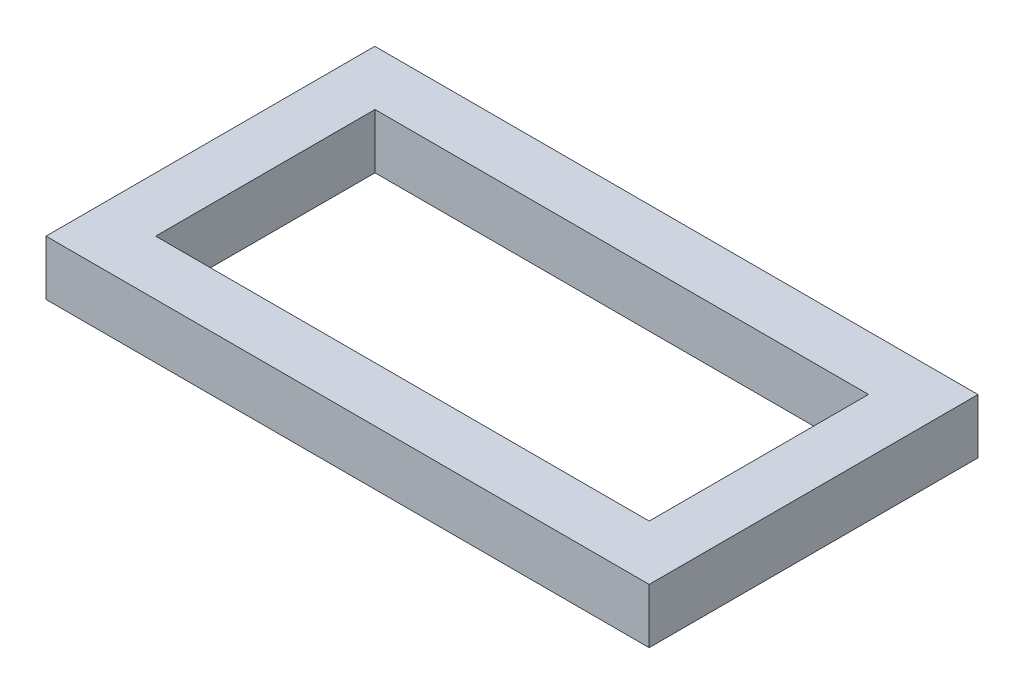
from build123d import *

# Parameters (mm, degrees)
SKETCH_1_W      = 180
SKETCH_1_H      = 80
EXTRUDE_1_DEPTH = 20


with BuildPart() as part:
    # 草图1 → 凸台-拉伸1 (new body)
    with BuildSketch(Plane(origin=(0, 0, 0), x_dir=(1, 0, 0), z_dir=(0, 1, 0))):
        Polygon((-110, -40), (-110, -60), (110, -60), (110, -40), (110, 40), (110, 59.931716483), (-110, 59.931716483), (-110, 40), align=None)
        Rectangle(SKETCH_1_W, SKETCH_1_H, mode=Mode.SUBTRACT)
    extrude(amount=-EXTRUDE_1_DEPTH)


solid = part.part
